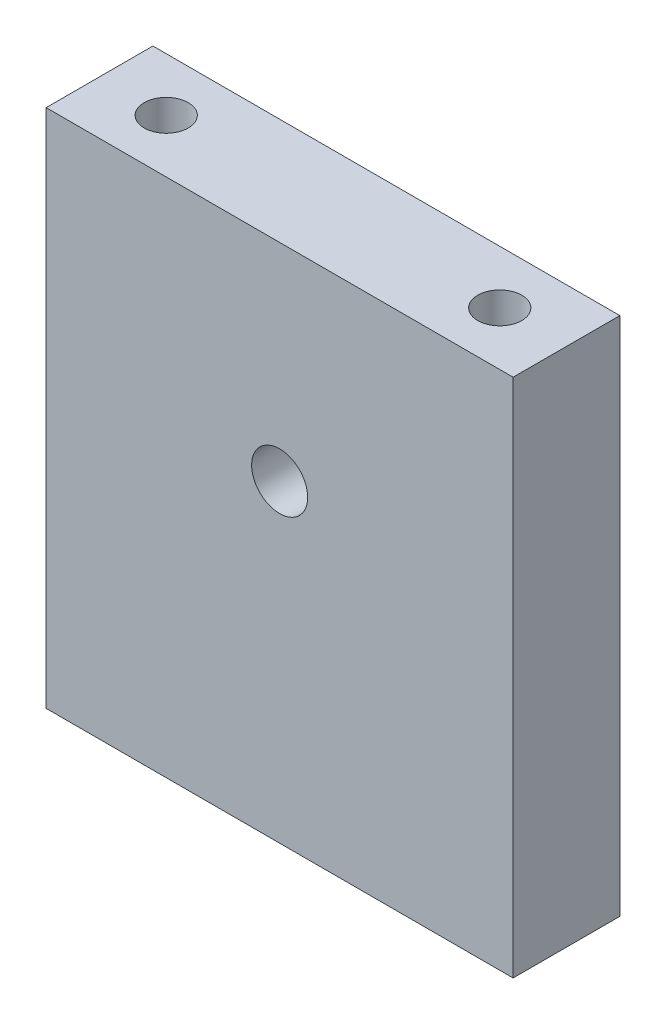
from build123d import *

# Parameters (mm, degrees)
SKETCH_1_W          = 35
SKETCH_1_H          = 39
SKETCH_1_R          = 2.1
EXTRUDE_1_DEPTH     = 8
SKETCH_2_R          = 1.65
CUT_EXTRUDE_1_DEPTH = 54.009433123


with BuildPart() as part:
    # 草图1 → 凸台-拉伸1 (new body)
    with BuildSketch(Plane.XY):
        with Locations((17.5, 19.5)):
            Rectangle(SKETCH_1_W, SKETCH_1_H)
        with Locations((17.5, 23.5)):
            Circle(SKETCH_1_R, mode=Mode.SUBTRACT)
    extrude(amount=EXTRUDE_1_DEPTH)

    # 草图2 → 切除-拉伸1 (cut, through all)
    with BuildSketch(Plane(origin=(0, 39, 0), x_dir=(1, 0, 0), z_dir=(0, 1, 0))):
        with Locations(Location((5, -4, 0), (0, 0, 270))):
            Circle(SKETCH_2_R)
        with Locations(Location((30, -4, 0), (0, 0, 270))):
            Circle(SKETCH_2_R)
    extrude(amount=-CUT_EXTRUDE_1_DEPTH, mode=Mode.SUBTRACT)


solid = part.part
